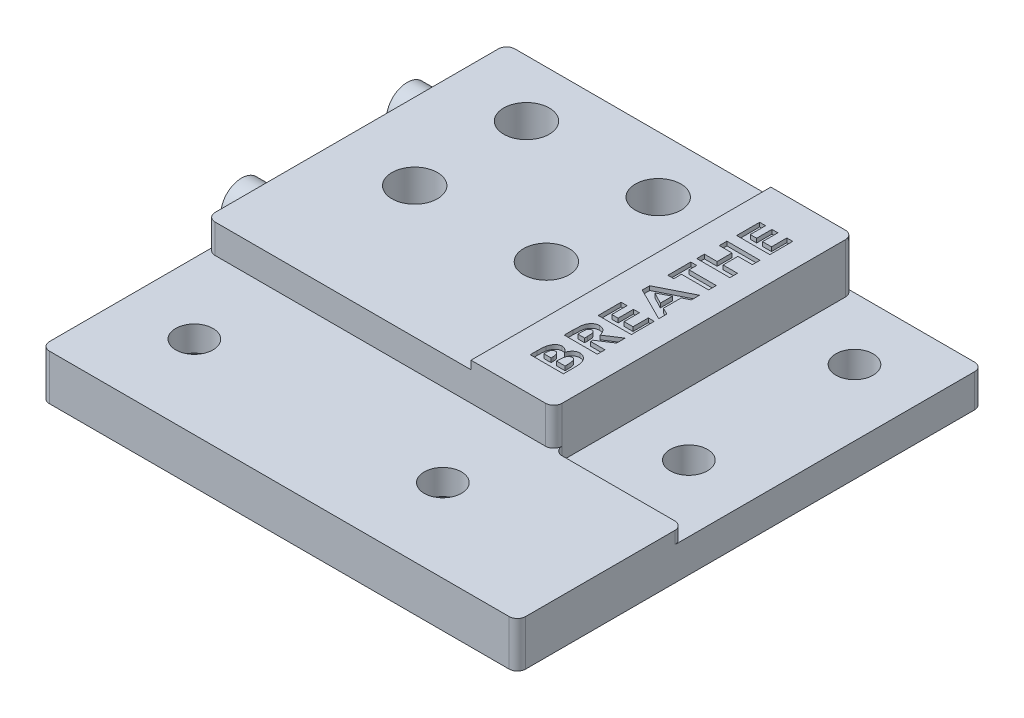
from build123d import *

# Parameters (mm, degrees)
SKETCH1_W                                       = 58
SKETCH1_H                                       = 56.2
BOSS_EXTRUDE1_DEPTH                             = 9
F_4_0MM_DOWEL_HOLE1_D                           = 4
CSK_FOR_M4_FLAT_HEAD_MACHINE_SCREW1_D           = 4.5
CSK_FOR_M4_FLAT_HEAD_MACHINE_SCREW1_CSINK_D     = 9.4
CSK_FOR_M4_FLAT_HEAD_MACHINE_SCREW1_CSINK_ANGLE = 90
SKETCH6_R                                       = 2.75
CUT_EXTRUDE1_DEPTH                              = 9
SKETCH7_R                                       = 4
CUT_EXTRUDE2_DEPTH                              = 1.5
SKETCH8_W                                       = 58
SKETCH8_H                                       = 20
CUT_EXTRUDE3_DEPTH                              = 3.5
SKETCH9_W                                       = 15.6
SKETCH9_H                                       = 36.2
CUT_EXTRUDE4_DEPTH                              = 5
M4_CLEARANCE_HOLE1_D                            = 4.5
SKETCH14_W                                      = 0.5
SKETCH14_H                                      = 56.2
CUT_EXTRUDE6_DEPTH                              = 42.371608622
SKETCH16_W                                      = 10
SKETCH16_H                                      = 36.2
BOSS_EXTRUDE3_DEPTH                             = 1
FILLET4_R                                       = 1
FILLET5_R                                       = 1
SKETCH15_R                                      = 2.5
BOSS_EXTRUDE2_DEPTH                             = 4
CUT_EXTRUDE5_DEPTH                              = 0.5


with BuildPart() as part:
    # Sketch1 → Boss-Extrude1 (new body)
    with BuildSketch(Plane(origin=(0, 0, 0), x_dir=(1, 0, 0), z_dir=(0, 1, 0))):
        Rectangle(SKETCH1_W, SKETCH1_H)
    extrude(amount=BOSS_EXTRUDE1_DEPTH)

    # Ø4.0mm Dowel Hole1 (through all)
    with Locations(Plane(origin=(-3.35, 0, -7.75), x_dir=(0, 0, -1), z_dir=(0, -1, 0))):
        with Locations((0, 0), (0, -15.9), (13.5, -15.9), (13.5, 0)):
            Hole(F_4_0MM_DOWEL_HOLE1_D / 2)

    # CSK for M4 Flat Head Machine Screw1 (through all)
    with Locations(Plane(origin=(-20, 0, 18.100422343), x_dir=(0, 0, -1), z_dir=(0, -1, 0))):
        with Locations((0, 0), (0, 30)):
            CounterSinkHole(CSK_FOR_M4_FLAT_HEAD_MACHINE_SCREW1_D / 2, CSK_FOR_M4_FLAT_HEAD_MACHINE_SCREW1_CSINK_D / 2, counter_sink_angle=CSK_FOR_M4_FLAT_HEAD_MACHINE_SCREW1_CSINK_ANGLE)

    # Sketch6 → Cut-Extrude1 (cut)
    with BuildSketch(Plane.XZ):
        with Locations(Location((-19.25, -21.25, 0), (0, 0, 270))):
            Circle(SKETCH6_R)
        with Locations(Location((-19.25, -7.75, 0), (0, 0, 270))):
            Circle(SKETCH6_R)
        with Locations(Location((-3.35, -21.25, 0), (0, 0, 270))):
            Circle(SKETCH6_R)
        with Locations(Location((-3.35, -7.75, 0), (0, 0, 270))):
            Circle(SKETCH6_R)
    extrude(amount=-CUT_EXTRUDE1_DEPTH, mode=Mode.SUBTRACT)

    # Sketch7 → Cut-Extrude2 (cut)
    with BuildSketch(Plane.XZ):
        with Locations(Location((-19.25, -21.25, 0), (0, 0, 270))):
            Circle(SKETCH7_R)
        with Locations(Location((-19.25, -7.75, 0), (0, 0, 270))):
            Circle(SKETCH7_R)
        with Locations(Location((-3.35, -21.25, 0), (0, 0, 270))):
            Circle(SKETCH7_R)
        with Locations(Location((-3.35, -7.75, 0), (0, 0, 270))):
            Circle(SKETCH7_R)
    extrude(amount=-CUT_EXTRUDE2_DEPTH, mode=Mode.SUBTRACT)

    # Sketch8 → Cut-Extrude3 (cut)
    with BuildSketch(Plane(origin=(0, 9, 0), x_dir=(1, 0, 0), z_dir=(0, 1, 0))):
        with Locations((0, -18.1)):
            Rectangle(SKETCH8_W, SKETCH8_H)
    extrude(amount=-CUT_EXTRUDE3_DEPTH, mode=Mode.SUBTRACT)

    # Sketch9 → Cut-Extrude4 (cut)
    with BuildSketch(Plane(origin=(0, 9, 0), x_dir=(1, 0, 0), z_dir=(0, 1, 0))):
        with Locations((21.2, 10)):
            Rectangle(SKETCH9_W, SKETCH9_H)
    extrude(amount=-CUT_EXTRUDE4_DEPTH, mode=Mode.SUBTRACT)

    # M4 Clearance Hole1 (through all)
    with Locations(Plane(origin=(21, 4, -20.6), x_dir=(0, 0, 1), z_dir=(0, 1, 0))):
        with Locations((0, 0), (20, 0)):
            Hole(M4_CLEARANCE_HOLE1_D / 2)

    # Sketch14 → Cut-Extrude6 (cut, through all)
    with BuildSketch(Plane.XZ):
        with Locations((-28.75, 0)):
            Rectangle(SKETCH14_W, SKETCH14_H)
    extrude(amount=-CUT_EXTRUDE6_DEPTH, mode=Mode.SUBTRACT)

    # Sketch16 → Boss-Extrude3 (add)
    with BuildSketch(Plane(origin=(0, 9, 0), x_dir=(1, 0, 0), z_dir=(0, 1, 0))):
        with Locations((8.4, 10)):
            Rectangle(SKETCH16_W, SKETCH16_H)
    extrude(amount=BOSS_EXTRUDE3_DEPTH)

    # Fillet4
    fillet4_edges = [part.edges().sort_by_distance(p)[0] for p in [
        (29, 2, -28.1),
        (29, 4.75, 8.1),
        (13.4, 4.75, 8.1),
        (13.4, 7, -28.1),
        (-28.5, 7.25, 8.1),
        (-28.5, 2.75, 28.1),
        (-28.5, 4.5, -28.1),
        (29, 2.75, 28.1),
    ]]
    fillet(fillet4_edges, radius=FILLET4_R)

    # Fillet5
    fillet5_edges = [part.edges().sort_by_distance(p)[0] for p in [
        (13.4, 7.75, 8.1),
    ]]
    fillet(fillet5_edges, radius=FILLET5_R)

    # Sketch15 → Boss-Extrude2 (add)
    with BuildSketch(Plane.ZY.offset(28.5)):
        with Locations(Location((-20.1, 4.5, 0), (0, 0, 180))):
            Circle(SKETCH15_R)
        with Locations(Location((-0.1, 4.5, 0), (0, 0, 180))):
            Circle(SKETCH15_R)
    extrude(amount=BOSS_EXTRUDE2_DEPTH)

    # Sketch13 → Cut-Extrude5 (cut)
    # profile 1 of 7: a face of its own
    with BuildSketch(Plane(origin=(0, 10, 0), x_dir=(1, 0, 0), z_dir=(0, 1, 0))):
        with BuildLine():
            Line((10.4, -3.948717949), (6.4, -3.948717949))
            Line((6.4, -3.948717949), (6.4, -3.147435897))
            add(Edge.make_bspline(
                [(6.4, -3.147435897), (6.399991676, -3.091342812), (6.399975581, -2.982879741), (6.404419646, -2.826088389), (6.409999317, -2.681051134), (6.416532058, -2.547660368), (6.427330208, -2.426156758), (6.439031303, -2.316019015), (6.452878979, -2.217530953), (6.46542402, -2.156199752), (6.471314103, -2.127403846)],
                knots=[0, 0, 0, 0, 1.31441287, 2.541583415, 3.675316184, 4.715842416, 5.670689375, 6.533301982, 7.31136359, 8, 8, 8, 8], degree=3))
            add(Edge.make_bspline(
                [(6.471314103, -2.127403846), (6.479635513, -2.09015097), (6.495990821, -2.016932336), (6.528522677, -1.911148565), (6.565083888, -1.810957305), (6.606755401, -1.716522745), (6.654311973, -1.628395908), (6.706030987, -1.545367719), (6.764270025, -1.46918879), (6.82633485, -1.398665555), (6.892829097, -1.335406393), (6.962462974, -1.279572995), (7.035893739, -1.23331688), (7.111260957, -1.193802667), (7.190617808, -1.165685389), (7.271857298, -1.143359474), (7.356574126, -1.130288548), (7.414112327, -1.128905815), (7.443269231, -1.128205128)],
                knots=[0, 0, 0, 0, 1.21019818, 2.378583016, 3.506881594, 4.591468139, 5.64885195, 6.680577369, 7.690334084, 8.686461008, 9.657121506, 10.597746537, 11.511869754, 12.405952242, 13.29035124, 14.175966465, 15.075689403, 16, 16, 16, 16], degree=3))
            add(Edge.make_bspline(
                [(7.443269231, -1.128205128), (7.480775667, -1.129497084), (7.554880918, -1.132049732), (7.663215605, -1.155233011), (7.765899136, -1.193269552), (7.863983754, -1.24645693), (7.957897387, -1.316499286), (8.048008238, -1.405133099), (8.134643718, -1.512597198), (8.186807396, -1.593226549), (8.214102564, -1.635416667)],
                knots=[0, 0, 0, 0, 0.928194798, 1.833928114, 2.729894123, 3.632844097, 4.588253273, 5.62228255, 6.755835462, 8, 8, 8, 8], degree=3))
            add(Edge.make_bspline(
                [(8.214102564, -1.635416667), (8.228433245, -1.598940926), (8.256313889, -1.527976596), (8.302954036, -1.426926342), (8.351926949, -1.333161266), (8.403932862, -1.247268669), (8.457185295, -1.167562763), (8.515460652, -1.097545105), (8.574683919, -1.033367701), (8.637408982, -0.976962914), (8.70347693, -0.928180223), (8.771506046, -0.885242797), (8.843116741, -0.849873822), (8.917138209, -0.819947409), (8.994672394, -0.798017351), (9.074290533, -0.780568761), (9.15724716, -0.771077397), (9.213546571, -0.769852854), (9.242147436, -0.769230769)],
                knots=[0, 0, 0, 0, 1.303418185, 2.535827823, 3.700292207, 4.820247881, 5.875009403, 6.885234664, 7.846981501, 8.778159732, 9.686203483, 10.576202651, 11.450361243, 12.339650541, 13.228140557, 14.127317036, 15.048651623, 16, 16, 16, 16], degree=3))
            add(Edge.make_bspline(
                [(9.242147436, -0.769230769), (9.269690236, -0.769784196), (9.324443314, -0.770884367), (9.405725728, -0.781655568), (9.48498889, -0.799379298), (9.562617097, -0.823379267), (9.637955406, -0.855074041), (9.711987719, -0.8924951), (9.783620446, -0.937902584), (9.876054123, -1.007294929), (9.983669648, -1.106349133), (10.097013129, -1.241688909), (10.191011352, -1.394346308), (10.25510598, -1.53323287), (10.29771287, -1.653836305), (10.32436382, -1.75396601), (10.348678089, -1.861827688), (10.367718998, -1.978493049), (10.381752129, -2.103412523), (10.392064528, -2.236507129), (10.398550028, -2.37787448), (10.399507152, -2.474886), (10.4, -2.524839744)],
                knots=[0, 0, 0, 0, 0.702394077, 1.396308237, 2.087372635, 2.772735835, 3.466214908, 4.170193782, 4.886724851, 5.626750774, 7.116948378, 8.607130403, 10.116030909, 11.677068225, 12.500321181, 13.376472401, 14.318832943, 15.320338354, 16.390410126, 17.525034604, 18.725576244, 20, 20, 20, 20], degree=3))
            Line((10.4, -2.524839744), (10.4, -3.948717949))
        make_face()
        with BuildLine():
            Line((7.117948718, -3.025641026), (7.98974359, -3.025641026))
            Line((7.98974359, -3.025641026), (7.98974359, -2.798878205))
            add(Edge.make_bspline(
                [(7.98974359, -2.798878205), (7.989519493, -2.768153049), (7.989086474, -2.708783361), (7.98342723, -2.622925373), (7.974016666, -2.543164762), (7.960319845, -2.469638089), (7.943907187, -2.401971477), (7.922981693, -2.340557368), (7.898298594, -2.28529077), (7.87010103, -2.235882432), (7.838721162, -2.192351453), (7.804481277, -2.15412909), (7.766127766, -2.123309566), (7.726958945, -2.095779255), (7.683689779, -2.075923216), (7.638002866, -2.061236058), (7.589359971, -2.053481078), (7.556273283, -2.052024069), (7.539423077, -2.051282051)],
                knots=[0, 0, 0, 0, 1.50694, 2.911834152, 4.218410663, 5.444186107, 6.578612203, 7.631009277, 8.622083953, 9.543507929, 10.416232427, 11.250851825, 12.051030307, 12.825037802, 13.592810382, 14.375967611, 15.172921721, 16, 16, 16, 16], degree=3))
            add(Edge.make_bspline(
                [(7.539423077, -2.051282051), (7.5236178, -2.051587804), (7.492543955, -2.052188927), (7.447630551, -2.061525937), (7.405301701, -2.075479748), (7.364735901, -2.093355501), (7.327649208, -2.119248714), (7.292465476, -2.149347888), (7.260112826, -2.185298402), (7.230353376, -2.226256404), (7.20395086, -2.27310514), (7.18070685, -2.325700336), (7.160582063, -2.383748406), (7.146027119, -2.448127791), (7.132821545, -2.517250299), (7.124499743, -2.59252496), (7.118548346, -2.673247112), (7.118152863, -2.729154129), (7.117948718, -2.758012821)],
                knots=[0, 0, 0, 0, 0.822172175, 1.616425315, 2.377808743, 3.143757469, 3.915751264, 4.724862834, 5.552435598, 6.429325996, 7.358028056, 8.348592315, 9.422469156, 10.55327442, 11.78437131, 13.087687704, 14.496690951, 16, 16, 16, 16], degree=3))
            Line((7.117948718, -2.758012821), (7.117948718, -3.025641026))
        make_face(mode=Mode.SUBTRACT)
        with BuildLine():
            Line((8.656410256, -3.025641026), (9.682051282, -3.025641026))
            Line((9.682051282, -3.025641026), (9.682051282, -2.770032051))
            add(Edge.make_bspline(
                [(9.682051282, -2.770032051), (9.681820299, -2.719280306), (9.681377625, -2.622015629), (9.675947656, -2.482489048), (9.666079271, -2.355875022), (9.654455972, -2.24198956), (9.635888742, -2.141455804), (9.617346975, -2.053081319), (9.592356788, -1.978055951), (9.564038397, -1.914981122), (9.532337372, -1.861686714), (9.496984751, -1.816487659), (9.458056235, -1.778402423), (9.416310591, -1.746638847), (9.370517753, -1.722289426), (9.321467019, -1.704604337), (9.268786566, -1.693869309), (9.232582666, -1.69283543), (9.214102564, -1.692307692)],
                knots=[0, 0, 0, 0, 1.864195047, 3.57269155, 5.127295437, 6.529274598, 7.774500025, 8.881232325, 9.843011531, 10.67283967, 11.416537475, 12.115257696, 12.774350176, 13.412065783, 14.035354505, 14.671558936, 15.321903801, 16, 16, 16, 16], degree=3))
            add(Edge.make_bspline(
                [(9.214102564, -1.692307692), (9.192949243, -1.693053144), (9.151618817, -1.694509644), (9.091231945, -1.706689058), (9.034941591, -1.728110798), (8.981059538, -1.756122553), (8.931629546, -1.793485843), (8.885094295, -1.838207922), (8.84288222, -1.891639112), (8.803427196, -1.952916133), (8.76743577, -2.023390388), (8.738627035, -2.105289259), (8.713045575, -2.19708499), (8.692578281, -2.299990182), (8.675605969, -2.413049337), (8.665185654, -2.537242766), (8.65755996, -2.671913426), (8.656803415, -2.765478841), (8.656410256, -2.814102564)],
                knots=[0, 0, 0, 0, 0.728715189, 1.423800558, 2.111223479, 2.798954537, 3.509653622, 4.238833849, 5.018072927, 5.85052574, 6.748034481, 7.738249037, 8.837140551, 10.030529151, 11.351973675, 12.775516634, 14.32431259, 16, 16, 16, 16], degree=3))
            Line((8.656410256, -2.814102564), (8.656410256, -3.025641026))
        make_face(mode=Mode.SUBTRACT)
    # profile 2 of 7: a face of its own
    with BuildSketch(Plane(origin=(0, 10, 0), x_dir=(1, 0, 0), z_dir=(0, 1, 0))):
        with BuildLine():
            Line((6.4, 0.153846154), (6.4, 1.217147436))
            add(Edge.make_bspline(
                [(6.4, 1.217147436), (6.400196134, 1.287398452), (6.400573558, 1.42258325), (6.406529603, 1.617320513), (6.414762452, 1.79637163), (6.427726253, 1.959600526), (6.44315791, 2.107498536), (6.463226409, 2.239518037), (6.485655001, 2.356122089), (6.5135536, 2.458509279), (6.545332348, 2.550790031), (6.581439803, 2.636723889), (6.62229468, 2.718359408), (6.669080152, 2.794565578), (6.718443148, 2.867738621), (6.774371856, 2.934941745), (6.834269237, 2.998480545), (6.899190473, 3.056787213), (6.967682933, 3.109860933), (7.040210245, 3.155304408), (7.11509051, 3.19530702), (7.193478547, 3.227282009), (7.275230684, 3.251251424), (7.359379567, 3.268632321), (7.446658984, 3.280762611), (7.505993662, 3.281616382), (7.536217949, 3.282051282)],
                knots=[0, 0, 0, 0, 1.900801792, 3.657733655, 5.271353062, 6.750224359, 8.087856983, 9.293950899, 10.362644476, 11.298863466, 12.162805574, 13.001718331, 13.819443638, 14.630047835, 15.419895656, 16.205533047, 16.992797603, 17.780857912, 18.564331605, 19.334254661, 20.093967851, 20.858956652, 21.620421007, 22.395752317, 23.182817809, 24, 24, 24, 24], degree=3))
            add(Edge.make_bspline(
                [(7.536217949, 3.282051282), (7.567768405, 3.281250255), (7.629736141, 3.279676971), (7.720631771, 3.268225537), (7.807726454, 3.249688988), (7.891199504, 3.224513345), (7.970193964, 3.190386784), (8.04512113, 3.149080365), (8.116884276, 3.10137045), (8.183382735, 3.044262205), (8.246968734, 2.981306123), (8.305684648, 2.909783652), (8.360800666, 2.831288195), (8.412506044, 2.745324622), (8.458371041, 2.651000429), (8.501798118, 2.550065846), (8.541315839, 2.44149193), (8.563361297, 2.365789093), (8.574679487, 2.326923077)],
                knots=[0, 0, 0, 0, 0.987706281, 1.939937771, 2.863383901, 3.773364493, 4.665022494, 5.552040712, 6.449678997, 7.357697634, 8.29202349, 9.248212856, 10.250539081, 11.293220518, 12.385306103, 13.531723533, 14.732780994, 16, 16, 16, 16], degree=3))
            Line((8.574679487, 2.326923077), (10.4, 3.512820513))
            Line((10.4, 3.512820513), (10.4, 2.476762821))
            Line((10.4, 2.476762821), (8.656410256, 1.344551282))
            Line((8.656410256, 1.344551282), (8.656410256, 1.076923077))
            Line((8.656410256, 1.076923077), (10.4, 1.076923077))
            Line((10.4, 1.076923077), (10.4, 0.153846154))
            Line((10.4, 0.153846154), (6.4, 0.153846154))
        make_face()
        with BuildLine():
            Line((7.938461538, 1.076923077), (7.938461538, 1.426282051))
            add(Edge.make_bspline(
                [(7.938461538, 1.426282051), (7.938076747, 1.469017965), (7.937340655, 1.550770212), (7.933921321, 1.668396755), (7.925631582, 1.775525152), (7.915382299, 1.872270434), (7.903234913, 1.9588809), (7.886163039, 2.034734898), (7.867635294, 2.100975262), (7.844817417, 2.157273653), (7.819287119, 2.20551261), (7.789013586, 2.24628961), (7.755078612, 2.281078604), (7.717455124, 2.310456078), (7.674938196, 2.33228427), (7.628868163, 2.34715109), (7.579132372, 2.35742322), (7.544553813, 2.358444281), (7.526602564, 2.358974359)],
                knots=[0, 0, 0, 0, 1.797703601, 3.438941594, 4.948587008, 6.315817414, 7.53130321, 8.624371836, 9.58427099, 10.420865392, 11.174935242, 11.873752375, 12.549054567, 13.2141871, 13.872452579, 14.54747435, 15.24593015, 16, 16, 16, 16], degree=3))
            add(Edge.make_bspline(
                [(7.526602564, 2.358974359), (7.505356623, 2.357752617), (7.463631712, 2.355353238), (7.403239101, 2.3357659), (7.347452759, 2.304082725), (7.296868415, 2.260068396), (7.252136663, 2.205981216), (7.213539788, 2.143130837), (7.182502544, 2.071516916), (7.16145693, 2.005645374), (7.149072705, 1.94492564), (7.140386, 1.890139369), (7.133267878, 1.826502332), (7.128035083, 1.754313503), (7.123043389, 1.673662341), (7.119951651, 1.584156598), (7.118591727, 1.486115453), (7.118168557, 1.41773536), (7.117948718, 1.382211538)],
                knots=[0, 0, 0, 0, 0.868246929, 1.705150448, 2.571812292, 3.479115993, 4.433934074, 5.435385574, 6.487888767, 7.622239104, 8.259170475, 9.023181451, 9.892598108, 10.879679282, 11.986015327, 13.200537625, 14.545664428, 16, 16, 16, 16], degree=3))
            Line((7.117948718, 1.382211538), (7.117948718, 1.076923077))
            Line((7.117948718, 1.076923077), (7.938461538, 1.076923077))
        make_face(mode=Mode.SUBTRACT)
    # profile 3 of 7: a face of its own
    with BuildSketch(Plane(origin=(0, 10, 0), x_dir=(1, 0, 0), z_dir=(0, 1, 0))):
        Polygon((6.4, 4.256410256), (6.4, 7.025641026), (7.117948718, 7.025641026), (7.117948718, 5.179487179), (7.887179487, 5.179487179), (7.887179487, 7.025641026), (8.605128205, 7.025641026), (8.605128205, 5.179487179), (9.682051282, 5.179487179), (9.682051282, 7.025641026), (10.4, 7.025641026), (10.4, 4.256410256), align=None)
    # profile 4 of 7: a face of its own
    with BuildSketch(Plane(origin=(0, 10, 0), x_dir=(1, 0, 0), z_dir=(0, 1, 0))):
        Polygon((6.4, 9.575320513), (6.4, 10.475160256), (10.4, 12.487179487), (10.4, 11.497596154), (9.579487179, 11.102564103), (9.579487179, 8.947916667), (10.4, 8.553685897), (10.4, 7.564102564), align=None)
        Polygon((7.472916667, 10.025641026), (8.861538462, 9.293269231), (8.861538462, 10.758012821), align=None, mode=Mode.SUBTRACT)
    # profile 5 of 7: a face of its own
    with BuildSketch(Plane(origin=(0, 10, 0), x_dir=(1, 0, 0), z_dir=(0, 1, 0))):
        Polygon((6.4, 12.666666667), (6.4, 15.435897436), (7.117948718, 15.435897436), (7.117948718, 14.512820513), (10.4, 14.512820513), (10.4, 13.58974359), (7.117948718, 13.58974359), (7.117948718, 12.666666667), align=None)
    # profile 6 of 7: a face of its own
    with BuildSketch(Plane(origin=(0, 10, 0), x_dir=(1, 0, 0), z_dir=(0, 1, 0))):
        Polygon((6.4, 16.153846154), (6.4, 17.076923077), (7.938461538, 17.076923077), (7.938461538, 18.871794872), (6.4, 18.871794872), (6.4, 19.794871795), (10.4, 19.794871795), (10.4, 18.871794872), (8.656410256, 18.871794872), (8.656410256, 17.076923077), (10.4, 17.076923077), (10.4, 16.153846154), align=None)
    # profile 7 of 7: a face of its own
    with BuildSketch(Plane(origin=(0, 10, 0), x_dir=(1, 0, 0), z_dir=(0, 1, 0))):
        Polygon((6.4, 20.974358974), (6.4, 23.743589744), (7.117948718, 23.743589744), (7.117948718, 21.897435897), (7.887179487, 21.897435897), (7.887179487, 23.743589744), (8.605128205, 23.743589744), (8.605128205, 21.897435897), (9.682051282, 21.897435897), (9.682051282, 23.743589744), (10.4, 23.743589744), (10.4, 20.974358974), align=None)
    extrude(amount=-CUT_EXTRUDE5_DEPTH, mode=Mode.SUBTRACT)


solid = part.part
